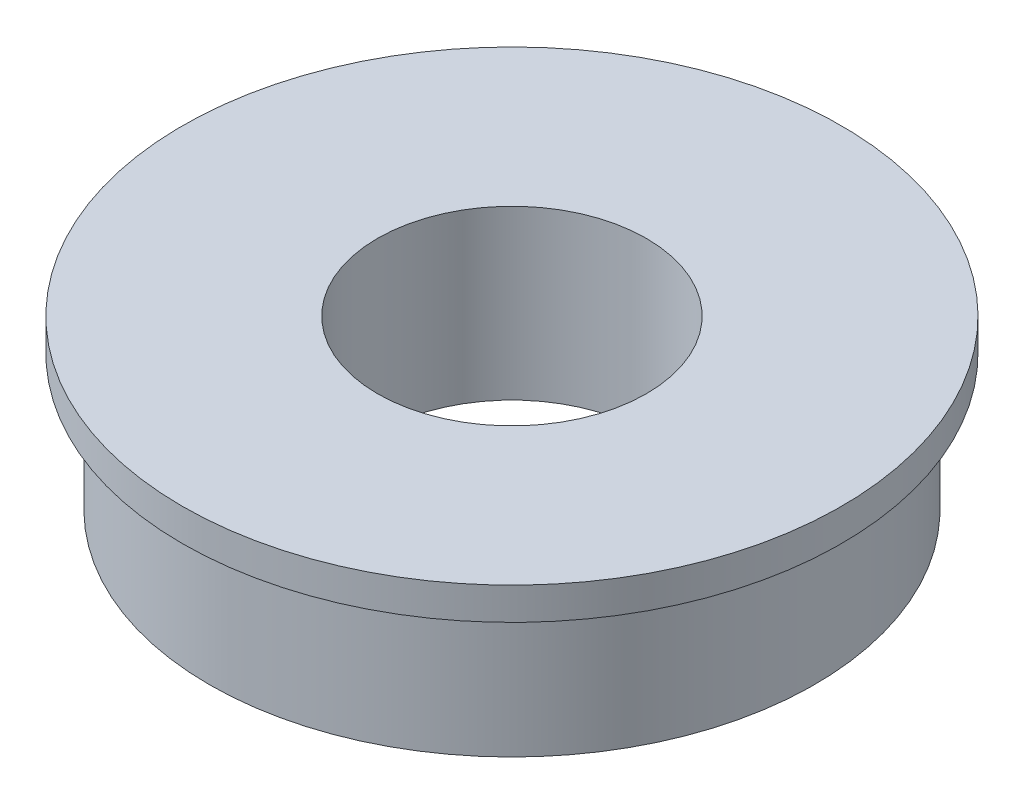
from build123d import *

# Parameters (mm, degrees)
SKETCH1_R           = 14.2875
BOSS_EXTRUDE1_DEPTH = 7.9248
SKETCH2_R           = 15.5575
BOSS_EXTRUDE2_DEPTH = 1.524
SKETCH3_R           = 6.35
CUT_EXTRUDE1_DEPTH  = 24.38533873


with BuildPart() as part:
    # Sketch1 → Boss-Extrude1 (new body)
    with BuildSketch(Plane(origin=(0, 0, 0), x_dir=(1, 0, 0), z_dir=(0, 1, 0))):
        with Locations(Location((0, 0, 0), (0, 0, 270))):
            Circle(SKETCH1_R)
    extrude(amount=BOSS_EXTRUDE1_DEPTH)

    # Sketch2 → Boss-Extrude2 (add)
    with BuildSketch(Plane(origin=(0, 7.9248, 0), x_dir=(1, 0, 0), z_dir=(0, 1, 0))):
        with Locations(Location((0, 0, 0), (0, 0, 270))):
            Circle(SKETCH2_R)
    extrude(amount=-BOSS_EXTRUDE2_DEPTH)

    # Sketch3 → Cut-Extrude1 (cut, through all)
    with BuildSketch(Plane(origin=(0, 7.9248, 0), x_dir=(1, 0, 0), z_dir=(0, 1, 0))):
        with Locations(Location((0, 0, 0), (0, 0, 270))):
            Circle(SKETCH3_R)
    extrude(amount=-CUT_EXTRUDE1_DEPTH, mode=Mode.SUBTRACT)


solid = part.part
